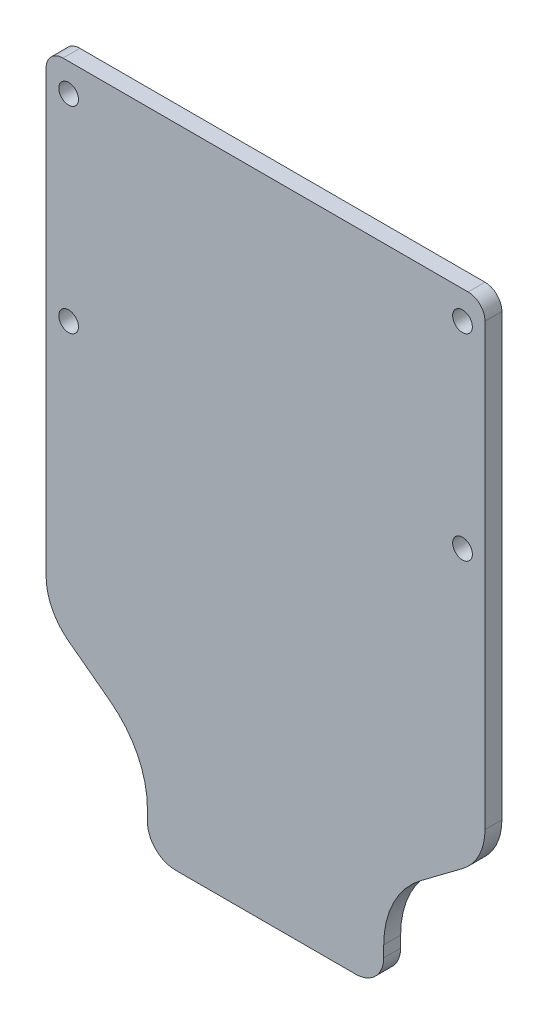
from build123d import *

# Parameters (mm, degrees)
SKETCH1_W           = 78
SKETCH1_H           = 45
SKETCH1_R           = 1.75
BOSS_EXTRUDE1_DEPTH = 3
SKETCH2_W           = 78
SKETCH2_H           = 3
BOSS_EXTRUDE2_DEPTH = 70
CUT_EXTRUDE1_DEPTH  = 101.430324106
FILLET1_R           = 5
FILLET2_R           = 10
FILLET3_R           = 3


with BuildPart() as part:
    # Sketch1 → Boss-Extrude1 (new body)
    with BuildSketch(Plane.XY):
        Rectangle(SKETCH1_W, SKETCH1_H)
        with Locations((-35, 17.5)):
            Circle(SKETCH1_R, mode=Mode.SUBTRACT)
        with Locations((35, 17.5)):
            Circle(SKETCH1_R, mode=Mode.SUBTRACT)
        with Locations((35, -17.5)):
            Circle(SKETCH1_R, mode=Mode.SUBTRACT)
        with Locations((-35, -17.5)):
            Circle(SKETCH1_R, mode=Mode.SUBTRACT)
    extrude(amount=BOSS_EXTRUDE1_DEPTH)

    # Sketch2 → Boss-Extrude2 (add)
    with BuildSketch(Plane.XZ.offset(22.5)):
        with Locations((0, 1.5)):
            Rectangle(SKETCH2_W, SKETCH2_H)
    extrude(amount=BOSS_EXTRUDE2_DEPTH)

    # Sketch3 → Cut-Extrude1 (cut, through all)
    with BuildSketch(Plane.XY.offset(3)):
        with BuildLine():
            Line((41, -36.924564207), (91.469533364, -36.924564207))
            Line((91.469533364, -36.924564207), (78.54293296, -118.649611561))
            Line((78.54293296, -118.649611561), (-67.027042434, -120.25516276))
            Line((-67.027042434, -120.25516276), (-84.509711048, -42.475126887))
            Line((-84.509711048, -42.475126887), (-81.655397805, -36.924564207))
            Line((-81.655397805, -36.924564207), (-41, -36.924564207))
            Line((-41, -36.924564207), (-41, -55.5))
            ThreePointArc((-41, -55.5), (-39.574767078, -61.537383539), (-35.6, -66.3))
            Line((-35.6, -66.3), (-27.6, -72.3))
            ThreePointArc((-27.6, -72.3), (-22.741951349, -78.120975674), (-21, -85.5))
            Line((-21, -85.5), (-21, -101))
            ThreePointArc((-21, -101), (-19.389087297, -104.889087297), (-15.5, -106.5))
            Line((-15.5, -106.5), (15.5, -106.5))
            ThreePointArc((15.5, -106.5), (19.389087297, -104.889087297), (21, -101))
            Line((21, -101), (21, -85.5))
            ThreePointArc((21, -85.5), (22.741951349, -78.120975674), (27.6, -72.3))
            Line((27.6, -72.3), (35.6, -66.3))
            ThreePointArc((35.6, -66.3), (39.574767078, -61.537383539), (41, -55.5))
            Line((41, -55.5), (41, -36.924564207))
        make_face()
    extrude(amount=-CUT_EXTRUDE1_DEPTH, mode=Mode.SUBTRACT)

    # Fillet1
    fillet1_edges = [part.edges().sort_by_distance(p)[0] for p in [
        (21, -92.5, 1.5),
        (-21, -92.5, 1.5),
    ]]
    fillet(fillet1_edges, radius=FILLET1_R)

    # Fillet2
    fillet2_edges = [part.edges().sort_by_distance(p)[0] for p in [
        (39, -62.571067812, 1.5),
        (-39, -62.571067812, 1.5),
    ]]
    fillet(fillet2_edges, radius=FILLET2_R)

    # Fillet3
    fillet3_edges = [part.edges().sort_by_distance(p)[0] for p in [
        (-39, 22.5, 1.5),
        (39, 22.5, 1.5),
    ]]
    fillet(fillet3_edges, radius=FILLET3_R)


solid = part.part
